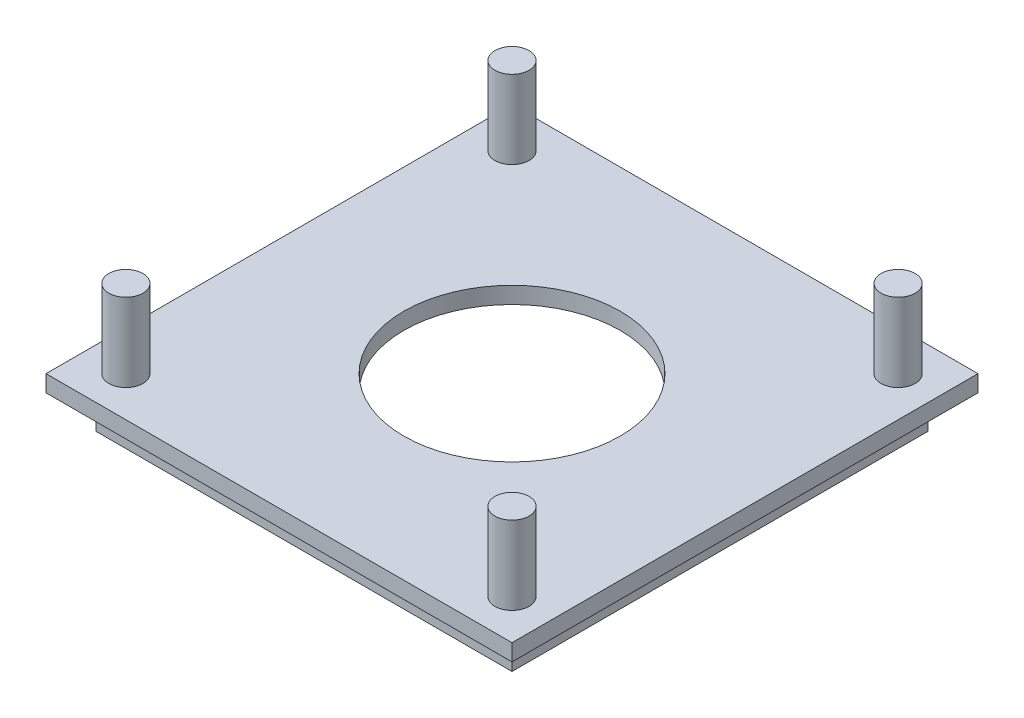
from build123d import *

# Parameters (mm, degrees)
SKETCH1_W           = 140
SKETCH1_H           = 140
BOSS_EXTRUDE1_DEPTH = 5
CUT_EXTRUDE1_REACH  = 101.121
SKETCH3_R           = 32.5
SKETCH4_R           = 5.125
BOSS_EXTRUDE2_DEPTH = 23.5
SKETCH5_W           = 125
SKETCH5_H           = 125
SKETCH5_W_2         = 121
SKETCH5_H_2         = 121
BOSS_EXTRUDE3_DEPTH = 10


with BuildPart() as part:
    # Sketch1 → Boss-Extrude1 (new body)
    with BuildSketch(Plane(origin=(0, 0, 0), x_dir=(1, 0, 0), z_dir=(0, 1, 0))):
        Rectangle(SKETCH1_W, SKETCH1_H)
    extrude(amount=BOSS_EXTRUDE1_DEPTH)

    # Sketch3 → Cut-Extrude1 (cut, up to next)
    with BuildSketch(Plane(origin=(0, 5, 0), x_dir=(1, 0, 0), z_dir=(0, 1, 0)), mode=Mode.PRIVATE) as cut_extrude1_sk1:
        Circle(SKETCH3_R)
    cut_extrude1_tool1 = extrude(cut_extrude1_sk1.sketch, amount=-CUT_EXTRUDE1_REACH, mode=Mode.PRIVATE) & part.part
    add(cut_extrude1_tool1.solids().sort_by_distance((0, 5, 0))[0], mode=Mode.SUBTRACT)

    # Sketch4 → Boss-Extrude2 (add)
    with BuildSketch(Plane(origin=(0, 5, 0), x_dir=(1, 0, 0), z_dir=(0, 1, 0))):
        with Locations((-58, 58)):
            Circle(SKETCH4_R)
        with Locations((58, 58)):
            Circle(SKETCH4_R)
        with Locations((58, -58)):
            Circle(SKETCH4_R)
        with Locations((-58, -58)):
            Circle(SKETCH4_R)
    extrude(amount=BOSS_EXTRUDE2_DEPTH)

    # Sketch5 → Boss-Extrude3 (add)
    with BuildSketch(Plane.XZ):
        Rectangle(SKETCH5_W, SKETCH5_H)
        Rectangle(SKETCH5_W_2, SKETCH5_H_2, mode=Mode.SUBTRACT)
    extrude(amount=BOSS_EXTRUDE3_DEPTH)


solid = part.part
